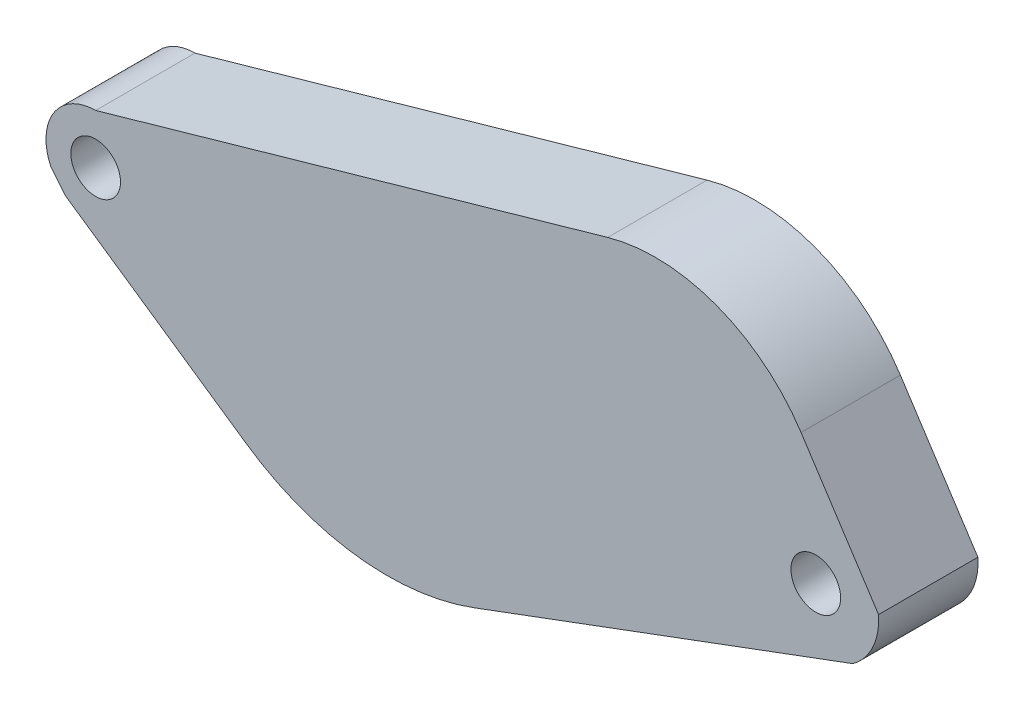
from build123d import *

# Parameters (mm, degrees)
SKETCH1_R           = 1
BOSS_EXTRUDE1_DEPTH = 4


with BuildPart() as part:
    # Sketch1 → Boss-Extrude1 (new body)
    with BuildSketch(Plane.XY):
        with BuildLine():
            Line((-14.257280668, -1.575118781), (-14.828930549, -0.86376259))
            ThreePointArc((-14.828930549, -0.86376259), (-14.717335158, 1.065944375), (-13.025069638, 2))
            Line((-13.025069638, 2), (7.597126091, 7.882366595))
            ThreePointArc((7.597126091, 7.882366595), (11.968265738, 7.707732331), (15.382140621, 4.972258475))
            Line((15.382140621, 4.972258475), (18.503191116, 0.182221363))
            ThreePointArc((18.503191116, 0.182221363), (18.275196012, -1.064934274), (17.471757811, -2.045681953))
            Line((17.471757811, -2.045681953), (2.208569451, -7.726919547))
            ThreePointArc((2.208569451, -7.726919547), (-2.503379707, -8.279944918), (-6.939921558, -6.599052796))
            Line((-6.939921558, -6.599052796), (-14.257280668, -1.575118781))
        make_face()
        with Locations((15.974930362, 0)):
            Circle(SKETCH1_R, mode=Mode.SUBTRACT)
        with Locations((-13.025069638, 0)):
            Circle(SKETCH1_R, mode=Mode.SUBTRACT)
    extrude(amount=BOSS_EXTRUDE1_DEPTH)


solid = part.part
